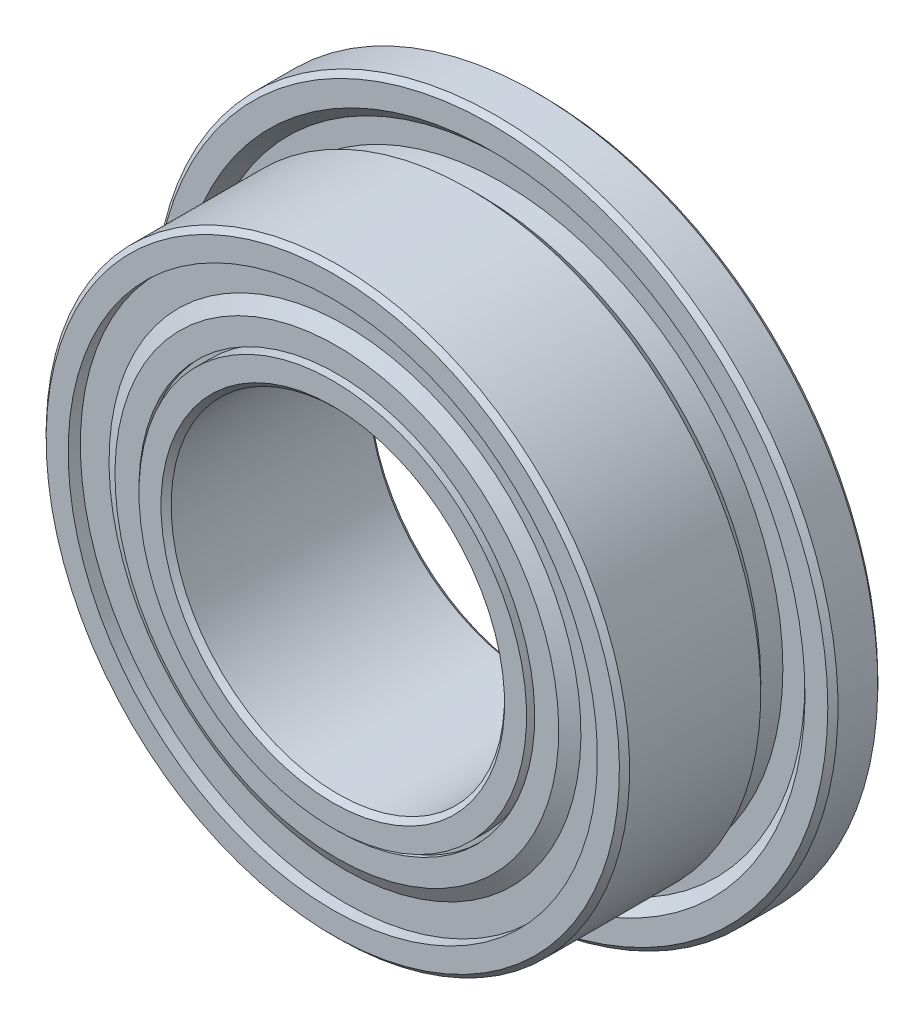
from build123d import *

# Parameters (mm, degrees)
FILLET1_SIZE      = 0.0609375
FILLET2_SIZE      = 0.0609375
CIRPATTERN3_COUNT = 13
SKETCH8_W         = 0.195
SKETCH8_H         = 0.1625


with BuildPart() as part:
    # Sketch2 → Revolve1 (revolve)
    with BuildSketch(Plane(origin=(0, 0, 0), x_dir=(0, 0, -1), z_dir=(1, 0, 0)), mode=Mode.PRIVATE) as revolve1_sk:
        with BuildLine():
            Line((1.25, 4.1), (0.65, 4.1))
            Line((0.65, 4.1), (0.65, 3.765165043))
            Line((0.65, 3.765165043), (0.782582521, 3.632582521))
            Line((0.782582521, 3.632582521), (0.782582521, 3.367417479))
            Line((0.782582521, 3.367417479), (0.517417479, 3.367417479))
            Line((0.517417479, 3.367417479), (0.384834957, 3.5))
            Line((0.384834957, 3.5), (-1.25, 3.5))
            Line((-1.25, 3.5), (-1.25, 3.0125))
            Line((-1.25, 3.0125), (-0.425551113, 3.0125))
            ThreePointArc((-0.425551113, 3.0125), (0, 3.25), (0.425551113, 3.0125))
            Line((0.425551113, 3.0125), (1.25, 3.0125))
            Line((1.25, 3.0125), (1.25, 4.1))
        make_face()
        with BuildLine():
            Line((1.25, 2), (-1.25, 2))
            Line((-1.25, 2), (-1.25, 2.4875))
            Line((-1.25, 2.4875), (-0.425551113, 2.4875))
            ThreePointArc((-0.425551113, 2.4875), (0, 2.25), (0.425551113, 2.4875))
            Line((0.425551113, 2.4875), (1.25, 2.4875))
            Line((1.25, 2.4875), (1.25, 2))
        make_face()
    revolve(revolve1_sk.sketch.rotate(Axis((0, 0, 0), (0, 0, -1)), 180), axis=Axis((0, 0, 0), (0, 0, -1)))

    # Fillet1
    fillet1_edges = [part.edges().sort_by_distance(p)[0] for p in [
        (0, 3.5, 1.25),
        (0, 4.1, -1.25),
        (0, 4.1, -0.65),
    ]]
    chamfer(fillet1_edges, length=FILLET1_SIZE)

    # Fillet2
    fillet2_edges = [part.edges().sort_by_distance(p)[0] for p in [
        (0, 2, -1.25),
        (0, 2, 1.25),
    ]]
    chamfer(fillet2_edges, length=FILLET2_SIZE)

    # Sketch8 → Cut-Revolve1 (revolve, cut)
    with BuildSketch(Plane(origin=(0, 0, 0), x_dir=(0, 0, -1), z_dir=(1, 0, 0)), mode=Mode.PRIVATE) as cut_revolve1_sk:
        with Locations((-1.1525, 3.09375)):
            Rectangle(SKETCH8_W, SKETCH8_H)
        with Locations((1.1525, 3.09375)):
            Rectangle(SKETCH8_W, SKETCH8_H)
        with Locations((1.1525, 2.40625)):
            Rectangle(SKETCH8_W, SKETCH8_H)
        with Locations((-1.1525, 2.40625)):
            Rectangle(SKETCH8_W, SKETCH8_H)
    revolve(cut_revolve1_sk.sketch.rotate(Axis((0, 0, 0), (0, 0, -1)), 180), axis=Axis((0, 0, 0), (0, 0, -1)), mode=Mode.SUBTRACT)


with BuildPart() as body_2:
    # Sketch7 → Revolve3 (revolve)
    with BuildSketch(Plane.XY):
        with BuildLine():
            Line((0, 3.25), (0, 2.25))
            ThreePointArc((0, 2.25), (-0.5, 2.75), (0, 3.25))
        make_face()
    revolve(axis=Axis((0, 3.25, 0), (0, -1, 0)))


with BuildPart() as cirpattern3_1:
    # CirPattern3: pattern copy
    add(body_2.part.rotate(Axis((0, 0, 0), (0, 0, 1)), 1 * 360 / CIRPATTERN3_COUNT))


with BuildPart() as cirpattern3_2:
    # CirPattern3: pattern copy
    add(body_2.part.rotate(Axis((0, 0, 0), (0, 0, 1)), 2 * 360 / CIRPATTERN3_COUNT))


with BuildPart() as cirpattern3_3:
    # CirPattern3: pattern copy
    add(body_2.part.rotate(Axis((0, 0, 0), (0, 0, 1)), 3 * 360 / CIRPATTERN3_COUNT))


with BuildPart() as cirpattern3_4:
    # CirPattern3: pattern copy
    add(body_2.part.rotate(Axis((0, 0, 0), (0, 0, 1)), 4 * 360 / CIRPATTERN3_COUNT))


with BuildPart() as cirpattern3_5:
    # CirPattern3: pattern copy
    add(body_2.part.rotate(Axis((0, 0, 0), (0, 0, 1)), 5 * 360 / CIRPATTERN3_COUNT))


with BuildPart() as cirpattern3_6:
    # CirPattern3: pattern copy
    add(body_2.part.rotate(Axis((0, 0, 0), (0, 0, 1)), 6 * 360 / CIRPATTERN3_COUNT))


with BuildPart() as cirpattern3_7:
    # CirPattern3: pattern copy
    add(body_2.part.rotate(Axis((0, 0, 0), (0, 0, 1)), 7 * 360 / CIRPATTERN3_COUNT))


with BuildPart() as cirpattern3_8:
    # CirPattern3: pattern copy
    add(body_2.part.rotate(Axis((0, 0, 0), (0, 0, 1)), 8 * 360 / CIRPATTERN3_COUNT))


with BuildPart() as cirpattern3_9:
    # CirPattern3: pattern copy
    add(body_2.part.rotate(Axis((0, 0, 0), (0, 0, 1)), 9 * 360 / CIRPATTERN3_COUNT))


with BuildPart() as cirpattern3_10:
    # CirPattern3: pattern copy
    add(body_2.part.rotate(Axis((0, 0, 0), (0, 0, 1)), 10 * 360 / CIRPATTERN3_COUNT))


with BuildPart() as cirpattern3_11:
    # CirPattern3: pattern copy
    add(body_2.part.rotate(Axis((0, 0, 0), (0, 0, 1)), 11 * 360 / CIRPATTERN3_COUNT))


with BuildPart() as cirpattern3_12:
    # CirPattern3: pattern copy
    add(body_2.part.rotate(Axis((0, 0, 0), (0, 0, 1)), 12 * 360 / CIRPATTERN3_COUNT))


with BuildPart() as body_15:
    # Sketch9 → Revolve4 (revolve)
    with BuildSketch(Plane(origin=(0, 0, 0), x_dir=(0, 0, -1), z_dir=(1, 0, 0)), mode=Mode.PRIVATE) as revolve4_sk:
        Polygon((-1.055, 3.175), (-1.055, 2.817857143), (-1.1525, 2.648982189), (-1.1525, 2.37375), (-1.20125, 2.37375), (-1.20125, 2.662044712), (-1.10375, 2.830919666), (-1.10375, 3.175), align=None)
        Polygon((1.055, 3.175), (1.055, 2.817857143), (1.1525, 2.648982189), (1.1525, 2.37375), (1.20125, 2.37375), (1.20125, 2.662044712), (1.10375, 2.830919666), (1.10375, 3.175), align=None)
    revolve(revolve4_sk.sketch.rotate(Axis((0, 0, 0), (0, 0, -1)), 180), axis=Axis((0, 0, 0), (0, 0, -1)))


solid = Compound([part.part, body_2.part, cirpattern3_1.part, cirpattern3_2.part, cirpattern3_3.part, cirpattern3_4.part, cirpattern3_5.part, cirpattern3_6.part, cirpattern3_7.part, cirpattern3_8.part, cirpattern3_9.part, cirpattern3_10.part, cirpattern3_11.part, cirpattern3_12.part, body_15.part])
